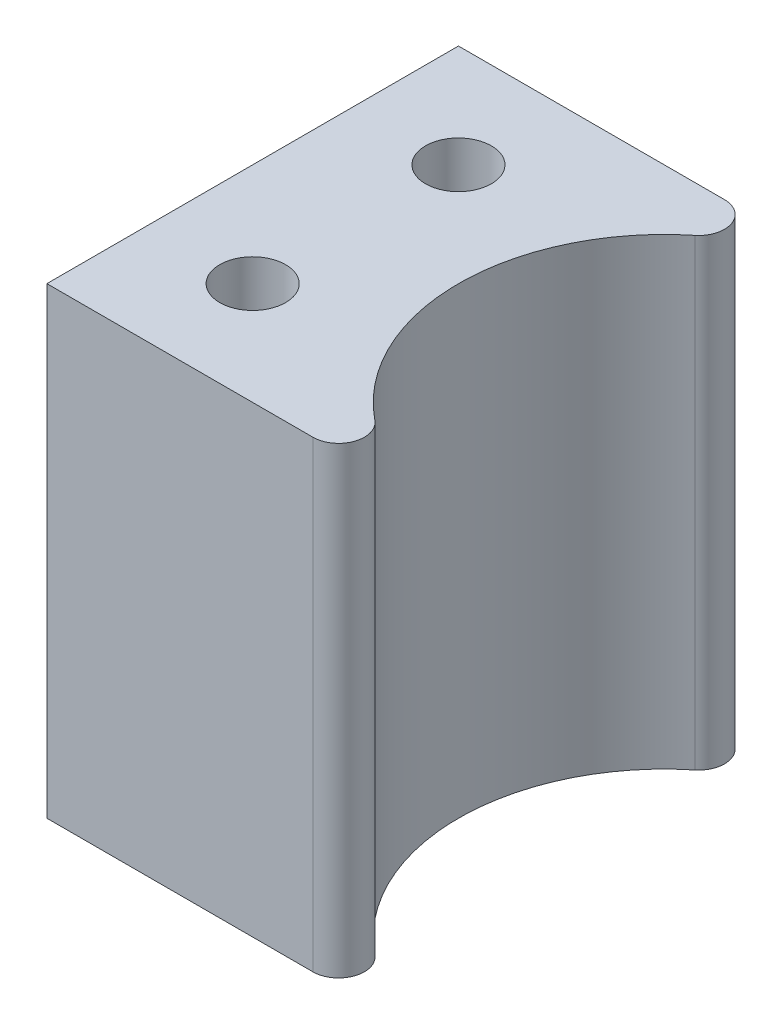
from build123d import *

# Parameters (mm, degrees)
SKETCH3_R           = 2.032
BOSS_EXTRUDE1_DEPTH = 28.575


with BuildPart() as part:
    # Sketch3 → Boss-Extrude1 (new body)
    with BuildSketch(Plane(origin=(0, 0, 0), x_dir=(1, 0, 0), z_dir=(0, 1, 0))):
        with BuildLine():
            Line((-27.78125, 0), (-27.78125, 25.4))
            Line((-27.78125, 25.4), (-11.361506121, 25.4))
            ThreePointArc((-11.361506121, 25.4), (-9.864796768, 24.341666667), (-10.363699885, 22.577777778))
            ThreePointArc((-10.363699885, 22.577777778), (-15.08125, 12.7), (-10.363699885, 2.822222222))
            ThreePointArc((-10.363699885, 2.822222222), (-9.864796768, 1.058333333), (-11.361506121, 0))
            Line((-11.361506121, 0), (-27.78125, 0))
        make_face()
        with Locations(Location((-21.43125, 6.35, 0), (0, 0, 270))):
            Circle(SKETCH3_R, mode=Mode.SUBTRACT)
        with Locations(Location((-21.43125, 19.05, 0), (0, 0, 270))):
            Circle(SKETCH3_R, mode=Mode.SUBTRACT)
    extrude(amount=BOSS_EXTRUDE1_DEPTH)


solid = part.part
